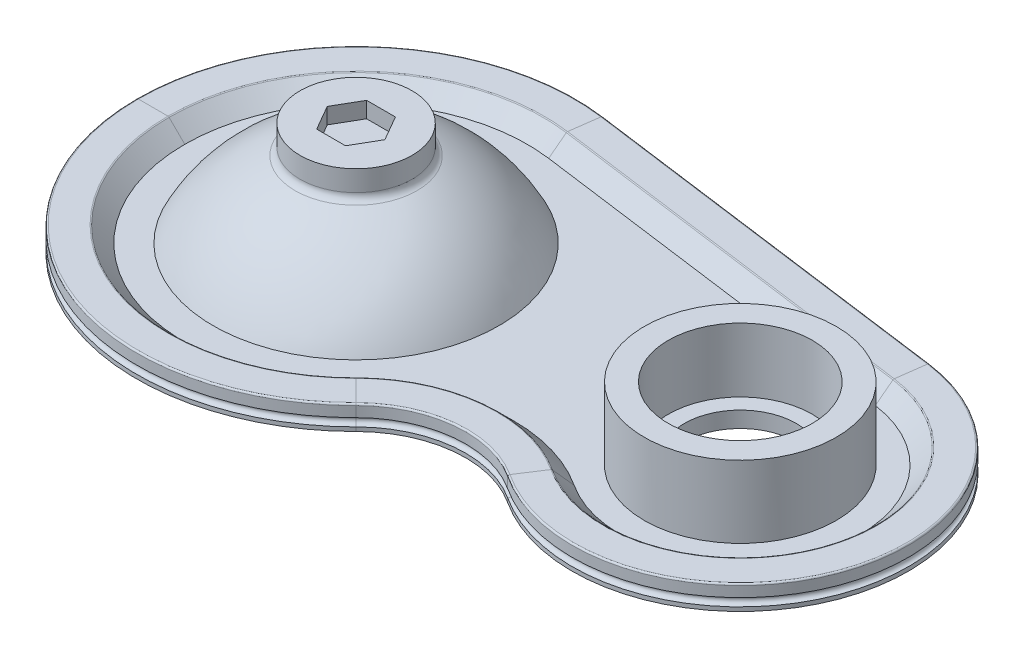
from build123d import *

# Parameters (mm, degrees)
BOSS_EXTRUDE1_START = 5
BOSS_EXTRUDE1_DEPTH = 5
CUT_EXTRUDE1_REACH  = 378.854
SKETCH5_R           = 60
CUT_EXTRUDE2_DEPTH  = 10
SKETCH10_R          = 35
CUT_EXTRUDE3_DEPTH  = 377.854083295


with BuildPart() as part:
    # Sweep1: sweep along a path in Sketch1
    with BuildLine(Plane(origin=(0, 0, 0), x_dir=(1, 0, 0), z_dir=(0, 1, 0))) as sweep1_path:
        Line((18.266666667, 135.776761226), (254, 104.062481231))
        ThreePointArc((254, 104.062481231), (338.422066507, -36.580005802), (182.637206187, -87.946062367))
        ThreePointArc((182.637206187, -87.946062367), (138.172201254, -77.200516784), (96.873629023, -96.873629023))
        ThreePointArc((96.873629023, -96.873629023), (-129.791652056, -43.853472571), (18.266666667, 135.776761226))
    # Sketch2 → Sweep1 (sweep)
    with BuildSketch(Plane.XY):
        with BuildLine():
            Line((-136, 15), (-117.501776985, 15))
            ThreePointArc((-117.501776985, 15), (-117.121168284, 14.924736187), (-116.797851706, 14.710274033))
            Line((-116.797851706, 14.710274033), (-107, 5))
            Line((-107, 5), (-107, 0))
            Line((-107, 0), (-137, 0))
            Line((-137, 0), (-137, 2.5))
            ThreePointArc((-137, 2.5), (-134.5, 5), (-137, 7.5))
            Line((-137, 7.5), (-137, 14))
            ThreePointArc((-137, 14), (-136.707106781, 14.707106781), (-136, 15))
        make_face()
    sweep(path=sweep1_path.line)

    # Sketch3 → Boss-Extrude1 (add)
    with BuildSketch(Plane(origin=(0, 0, 0), x_dir=(1, 0, 0), z_dir=(0, 1, 0)).offset(BOSS_EXTRUDE1_START)):
        with BuildLine():
            Line((14.266666667, 106.044623731), (250, 74.330343737))
            ThreePointArc((250, 74.330343737), (310.301476077, -26.128575573), (199.026575848, -62.818615977))
            ThreePointArc((199.026575848, -62.818615977), (135.066131785, -47.361744482), (75.660425587, -75.660425587))
            ThreePointArc((75.660425587, -75.660425587), (-40.947127263, -98.855109979), (-107, 0))
            ThreePointArc((-107, 0), (-70.436022981, 80.54667384), (14.266666667, 106.044623731))
        make_face()
    extrude(amount=-BOSS_EXTRUDE1_DEPTH)

    # Sketch4 → Revolve1 (revolve)
    with BuildSketch(Plane(origin=(0, 0, 0), x_dir=(0, 0, -1), z_dir=(1, 0, 0)), mode=Mode.PRIVATE) as revolve1_sk:
        with BuildLine():
            Line((60, 0), (60, 27.082039325))
            ThreePointArc((60, 27.082039325), (32.11398808, 44.075512307), (0, 50))
            Line((0, 50), (0, 70))
            Line((0, 70), (35, 70))
            Line((35, 70), (35, 57.082439195))
            ThreePointArc((35, 57.082439195), (35.845255151, 54.300695993), (38.095238095, 52.4594659))
            ThreePointArc((38.095238095, 52.4594659), (69.975379984, 31.43840841), (91.651513899, 0))
            Line((91.651513899, 0), (60, 0))
        make_face()
    revolve(revolve1_sk.sketch.rotate(Axis((0, 70, 0), (0, -1, 0)), 180), axis=Axis((0, 70, 0), (0, -1, 0)))

    # Sketch5 → Cut-Extrude1 (cut, up to next)
    with BuildSketch(Plane(origin=(0, 5, 0), x_dir=(1, 0, 0), z_dir=(0, 1, 0)), mode=Mode.PRIVATE) as cut_extrude1_sk1:
        with Locations(Location((0, 0, 0), (0, 0, 270))):
            Circle(SKETCH5_R)
    cut_extrude1_tool1 = extrude(cut_extrude1_sk1.sketch, amount=-CUT_EXTRUDE1_REACH, mode=Mode.PRIVATE) & part.part
    add(cut_extrude1_tool1.solids().sort_by_distance((0, 5, 0))[0], mode=Mode.SUBTRACT)

    # Sketch6 → Cut-Extrude2 (cut)
    with BuildSketch(Plane(origin=(0, 70, 0), x_dir=(1, 0, 0), z_dir=(0, 1, 0))):
        Polygon((-18, 0), (-9, -15.588457268), (9, -15.588457268), (18, 0), (9, 15.588457268), (-9, 15.588457268), align=None)
    extrude(amount=-CUT_EXTRUDE2_DEPTH, mode=Mode.SUBTRACT)

    # Sketch8 → Revolve2 (revolve)
    with BuildSketch(Plane(origin=(240, 0, 0), x_dir=(0, 0, -1), z_dir=(1, 0, 0))):
        Polygon((60, 0), (60, 50), (45, 50), (45, 10), (35, 10), (35, 0), align=None)
    revolve(axis=Axis((240, 0, 0), (0, 1, 0)))

    # Sketch10 → Cut-Extrude3 (cut, through all)
    with BuildSketch(Plane(origin=(0, 5, 0), x_dir=(1, 0, 0), z_dir=(0, 1, 0))):
        with Locations(Location((240, 0, 0), (0, 0, 90))):
            Circle(SKETCH10_R)
    extrude(amount=-CUT_EXTRUDE3_DEPTH, mode=Mode.SUBTRACT)


solid = part.part
